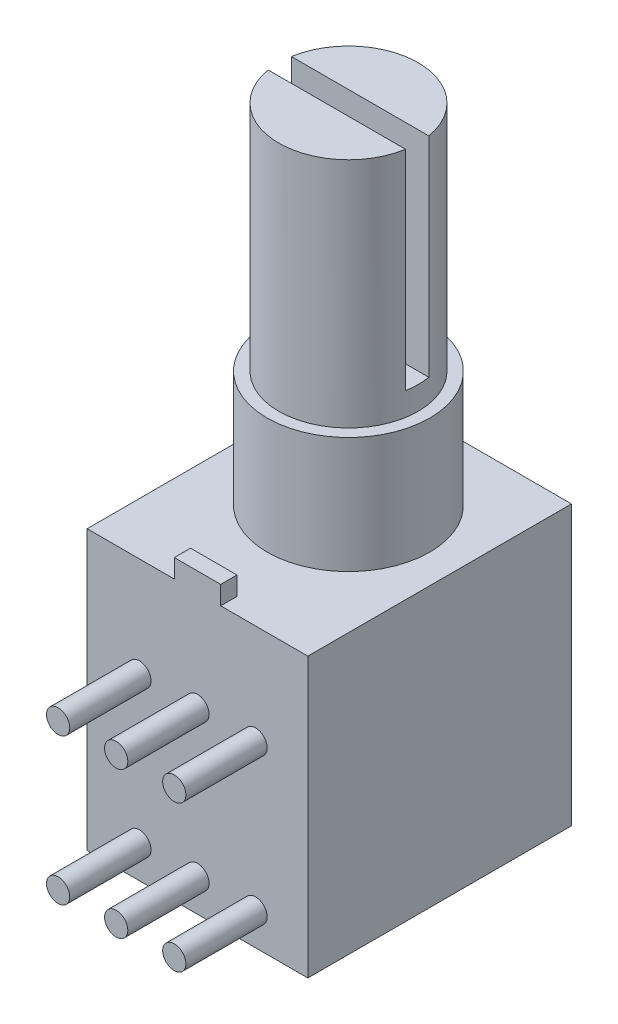
from build123d import *

# Parameters (mm, degrees)
SKETCH2_W           = 9.5
SKETCH2_H           = 11.35
BOSS_EXTRUDE1_DEPTH = 12
SKETCH3_R           = 3.5
BOSS_EXTRUDE2_DEPTH = 5
SKETCH4_R           = 3
BOSS_EXTRUDE3_DEPTH = 10
SKETCH5_W           = 10
SKETCH5_H           = 1
CUT_EXTRUDE1_DEPTH  = 9
SKETCH6_W           = 2
SKETCH6_H           = 0.7
BOSS_EXTRUDE4_DEPTH = 0.8
SKETCH7_R           = 0.5
BOSS_EXTRUDE5_DEPTH = 3.5


with BuildPart() as part:
    # Sketch2 → Boss-Extrude1 (new body)
    with BuildSketch(Plane(origin=(0, 0, 0), x_dir=(1, 0, 0), z_dir=(0, 1, 0))):
        with Locations((0, -0.825)):
            Rectangle(SKETCH2_W, SKETCH2_H)
    extrude(amount=-BOSS_EXTRUDE1_DEPTH)

    # Sketch3 → Boss-Extrude2 (add)
    with BuildSketch(Plane(origin=(0, 0, 0), x_dir=(1, 0, 0), z_dir=(0, 1, 0))):
        with Locations(Location((0, 0, 0), (0, 0, 270))):
            Circle(SKETCH3_R)
    extrude(amount=BOSS_EXTRUDE2_DEPTH)

    # Sketch4 → Boss-Extrude3 (add)
    with BuildSketch(Plane(origin=(0, 5, 0), x_dir=(1, 0, 0), z_dir=(0, 1, 0))):
        with Locations(Location((0, 0, 0), (0, 0, 270))):
            Circle(SKETCH4_R)
    extrude(amount=BOSS_EXTRUDE3_DEPTH)

    # Sketch5 → Cut-Extrude1 (cut)
    with BuildSketch(Plane(origin=(0, 15, 0), x_dir=(1, 0, 0), z_dir=(0, 1, 0))):
        Rectangle(SKETCH5_W, SKETCH5_H)
    extrude(amount=-CUT_EXTRUDE1_DEPTH, mode=Mode.SUBTRACT)

    # Sketch6 → Boss-Extrude4 (add)
    with BuildSketch(Plane(origin=(0, 0, 0), x_dir=(1, 0, 0), z_dir=(0, 1, 0))):
        with Locations((0, -6.15)):
            Rectangle(SKETCH6_W, SKETCH6_H)
    extrude(amount=BOSS_EXTRUDE4_DEPTH)

    # Sketch7 → Boss-Extrude5 (add)
    with BuildSketch(Plane.XY.offset(6.5)):
        with Locations((-2.5, -4.3)):
            Circle(SKETCH7_R)
        with Locations((0, -4.3)):
            Circle(SKETCH7_R)
        with Locations((2.5, -4.3)):
            Circle(SKETCH7_R)
        with Locations((0, -10.6)):
            Circle(SKETCH7_R)
        with Locations((2.5, -10.6)):
            Circle(SKETCH7_R)
        with Locations((-2.5, -10.6)):
            Circle(SKETCH7_R)
    extrude(amount=BOSS_EXTRUDE5_DEPTH)


solid = part.part
